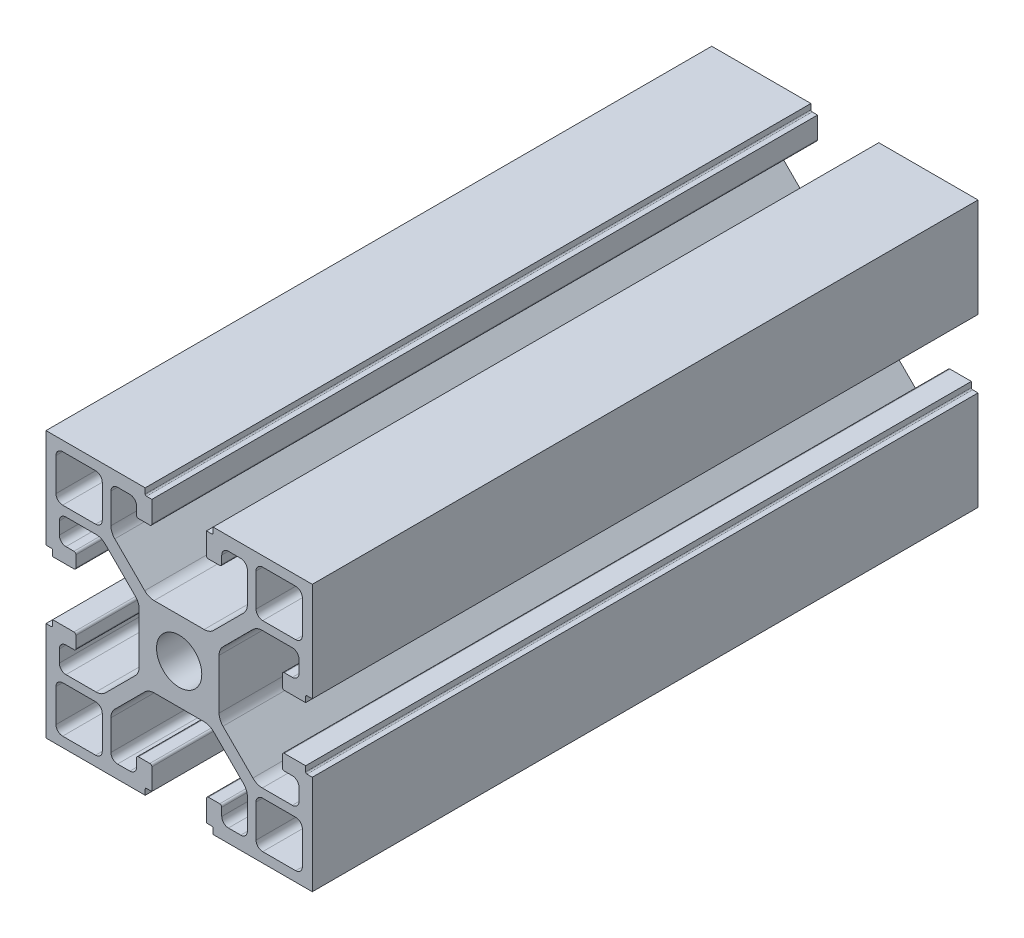
from build123d import *

# Parameters (mm, degrees)
SKETCH_1_R      = 3.4
EXTRUDE_1_DEPTH = 100


with BuildPart() as part:
    # 草图1 → 凸台-拉伸1 (new body)
    with BuildSketch(Plane.XY):
        with BuildLine():
            Line((-4.674392903, 18.940182328), (-19.574392903, 18.940182328))
            Line((-19.574392903, 18.940182328), (-19.574392903, 4.040182328))
            Line((-19.574392903, 4.040182328), (-18.774392903, 4.040182328))
            ThreePointArc((-18.774392903, 4.040182328), (-18.632971547, 3.981603684), (-18.574392903, 3.840182328))
            Line((-18.574392903, 3.840182328), (-18.574392903, 3.040182328))
            Line((-18.574392903, 3.040182328), (-15.374392903, 3.040182328))
            ThreePointArc((-15.374392903, 3.040182328), (-15.162260869, 3.128050294), (-15.074392903, 3.340182328))
            Line((-15.074392903, 3.340182328), (-15.074392903, 5.040182328))
            ThreePointArc((-15.074392903, 5.040182328), (-15.162260869, 5.252314363), (-15.374392903, 5.340182328))
            Line((-15.374392903, 5.340182328), (-16.574392903, 5.340182328))
            ThreePointArc((-16.574392903, 5.340182328), (-17.281499684, 5.633075547), (-17.574392903, 6.340182328))
            Line((-17.574392903, 6.340182328), (-17.574392903, 8.190182328))
            ThreePointArc((-17.574392903, 8.190182328), (-17.281499684, 8.897289109), (-16.574392903, 9.190182328))
            Line((-16.574392903, 9.190182328), (-12.06703359, 9.190182328))
            ThreePointArc((-12.06703359, 9.190182328), (-11.301666726, 9.037941393), (-10.652820028, 8.604395891))
            Line((-10.652820028, 8.604395891), (-6.160179341, 4.111755203))
            ThreePointArc((-6.160179341, 4.111755203), (-5.726633838, 3.462908506), (-5.574392903, 2.697541641))
            Line((-5.574392903, 2.697541641), (-5.574392903, -4.817176985))
            ThreePointArc((-5.574392903, -4.817176985), (-5.726633838, -5.582543849), (-6.160179341, -6.231390547))
            Line((-6.160179341, -6.231390547), (-10.652820028, -10.724031234))
            ThreePointArc((-10.652820028, -10.724031234), (-11.301666726, -11.157576737), (-12.06703359, -11.309817672))
            Line((-12.06703359, -11.309817672), (-16.574392903, -11.309817672))
            ThreePointArc((-16.574392903, -11.309817672), (-17.281499684, -11.016924453), (-17.574392903, -10.309817672))
            Line((-17.574392903, -10.309817672), (-17.574392903, -8.459817672))
            ThreePointArc((-17.574392903, -8.459817672), (-17.281499684, -7.752710891), (-16.574392903, -7.459817672))
            Line((-16.574392903, -7.459817672), (-15.374392903, -7.459817672))
            ThreePointArc((-15.374392903, -7.459817672), (-15.162260869, -7.371949706), (-15.074392903, -7.159817672))
            Line((-15.074392903, -7.159817672), (-15.074392903, -5.459817672))
            ThreePointArc((-15.074392903, -5.459817672), (-15.162260869, -5.247685637), (-15.374392903, -5.159817672))
            Line((-15.374392903, -5.159817672), (-18.574392903, -5.159817672))
            Line((-18.574392903, -5.159817672), (-18.574392903, -5.959817672))
            ThreePointArc((-18.574392903, -5.959817672), (-18.632971547, -6.101239028), (-18.774392903, -6.159817672))
            Line((-18.774392903, -6.159817672), (-19.574392903, -6.159817672))
            Line((-19.574392903, -6.159817672), (-19.574392903, -21.059817672))
            Line((-19.574392903, -21.059817672), (-4.674392903, -21.059817672))
            Line((-4.674392903, -21.059817672), (-4.674392903, -20.259817672))
            ThreePointArc((-4.674392903, -20.259817672), (-4.615814259, -20.118396316), (-4.474392903, -20.059817672))
            Line((-4.474392903, -20.059817672), (-3.674392903, -20.059817672))
            Line((-3.674392903, -20.059817672), (-3.674392903, -16.859817672))
            ThreePointArc((-3.674392903, -16.859817672), (-3.762260869, -16.647685637), (-3.974392903, -16.559817672))
            Line((-3.974392903, -16.559817672), (-5.674392903, -16.559817672))
            ThreePointArc((-5.674392903, -16.559817672), (-5.886524938, -16.647685637), (-5.974392903, -16.859817672))
            Line((-5.974392903, -16.859817672), (-5.974392903, -18.059817672))
            ThreePointArc((-5.974392903, -18.059817672), (-6.267286122, -18.766924453), (-6.974392903, -19.059817672))
            Line((-6.974392903, -19.059817672), (-8.824392903, -19.059817672))
            ThreePointArc((-8.824392903, -19.059817672), (-9.531499684, -18.766924453), (-9.824392903, -18.059817672))
            Line((-9.824392903, -18.059817672), (-9.824392903, -13.552458359))
            ThreePointArc((-9.824392903, -13.552458359), (-9.672151968, -12.787091494), (-9.238606466, -12.138244797))
            Line((-9.238606466, -12.138244797), (-4.745965779, -7.645604109))
            ThreePointArc((-4.745965779, -7.645604109), (-4.097119081, -7.212058607), (-3.331752216, -7.059817672))
            Line((-3.331752216, -7.059817672), (4.18296641, -7.059817672))
            ThreePointArc((4.18296641, -7.059817672), (4.948333274, -7.212058607), (5.597179972, -7.645604109))
            Line((5.597179972, -7.645604109), (10.089820659, -12.138244797))
            ThreePointArc((10.089820659, -12.138244797), (10.523366162, -12.787091494), (10.675607097, -13.552458359))
            Line((10.675607097, -13.552458359), (10.675607097, -18.059817672))
            ThreePointArc((10.675607097, -18.059817672), (10.382713878, -18.766924453), (9.675607097, -19.059817672))
            Line((9.675607097, -19.059817672), (7.825607097, -19.059817672))
            ThreePointArc((7.825607097, -19.059817672), (7.118500316, -18.766924453), (6.825607097, -18.059817672))
            Line((6.825607097, -18.059817672), (6.825607097, -16.859817672))
            ThreePointArc((6.825607097, -16.859817672), (6.737739131, -16.647685637), (6.525607097, -16.559817672))
            Line((6.525607097, -16.559817672), (4.825607097, -16.559817672))
            ThreePointArc((4.825607097, -16.559817672), (4.613475062, -16.647685637), (4.525607097, -16.859817672))
            Line((4.525607097, -16.859817672), (4.525607097, -20.059817672))
            Line((4.525607097, -20.059817672), (5.325607097, -20.059817672))
            ThreePointArc((5.325607097, -20.059817672), (5.467028453, -20.118396316), (5.525607097, -20.259817672))
            Line((5.525607097, -20.259817672), (5.525607097, -21.059817672))
            Line((5.525607097, -21.059817672), (20.425607097, -21.059817672))
            Line((20.425607097, -21.059817672), (20.425607097, -6.159817672))
            Line((20.425607097, -6.159817672), (19.625607097, -6.159817672))
            ThreePointArc((19.625607097, -6.159817672), (19.484185741, -6.101239028), (19.425607097, -5.959817672))
            Line((19.425607097, -5.959817672), (19.425607097, -5.159817672))
            Line((19.425607097, -5.159817672), (16.225607097, -5.159817672))
            ThreePointArc((16.225607097, -5.159817672), (16.013475062, -5.247685637), (15.925607097, -5.459817672))
            Line((15.925607097, -5.459817672), (15.925607097, -7.159817672))
            ThreePointArc((15.925607097, -7.159817672), (16.013475062, -7.371949706), (16.225607097, -7.459817672))
            Line((16.225607097, -7.459817672), (17.425607097, -7.459817672))
            ThreePointArc((17.425607097, -7.459817672), (18.132713878, -7.752710891), (18.425607097, -8.459817672))
            Line((18.425607097, -8.459817672), (18.425607097, -10.309817672))
            ThreePointArc((18.425607097, -10.309817672), (18.132713878, -11.016924453), (17.425607097, -11.309817672))
            Line((17.425607097, -11.309817672), (12.918247784, -11.309817672))
            ThreePointArc((12.918247784, -11.309817672), (12.152880919, -11.157576737), (11.504034221, -10.724031234))
            Line((11.504034221, -10.724031234), (7.011393534, -6.231390547))
            ThreePointArc((7.011393534, -6.231390547), (6.577848032, -5.582543849), (6.425607097, -4.817176985))
            Line((6.425607097, -4.817176985), (6.425607097, 2.697541641))
            ThreePointArc((6.425607097, 2.697541641), (6.577848032, 3.462908506), (7.011393534, 4.111755203))
            Line((7.011393534, 4.111755203), (11.504034221, 8.604395891))
            ThreePointArc((11.504034221, 8.604395891), (12.152880919, 9.037941393), (12.918247784, 9.190182328))
            Line((12.918247784, 9.190182328), (17.425607097, 9.190182328))
            ThreePointArc((17.425607097, 9.190182328), (18.132713878, 8.897289109), (18.425607097, 8.190182328))
            Line((18.425607097, 8.190182328), (18.425607097, 6.340182328))
            ThreePointArc((18.425607097, 6.340182328), (18.132713878, 5.633075547), (17.425607097, 5.340182328))
            Line((17.425607097, 5.340182328), (16.225607097, 5.340182328))
            ThreePointArc((16.225607097, 5.340182328), (16.013475062, 5.252314363), (15.925607097, 5.040182328))
            Line((15.925607097, 5.040182328), (15.925607097, 3.340182328))
            ThreePointArc((15.925607097, 3.340182328), (16.013475062, 3.128050294), (16.225607097, 3.040182328))
            Line((16.225607097, 3.040182328), (19.425607097, 3.040182328))
            Line((19.425607097, 3.040182328), (19.425607097, 3.840182328))
            ThreePointArc((19.425607097, 3.840182328), (19.484185741, 3.981603684), (19.625607097, 4.040182328))
            Line((19.625607097, 4.040182328), (20.425607097, 4.040182328))
            Line((20.425607097, 4.040182328), (20.425607097, 18.940182328))
            Line((20.425607097, 18.940182328), (5.525607097, 18.940182328))
            Line((5.525607097, 18.940182328), (5.525607097, 18.140182328))
            ThreePointArc((5.525607097, 18.140182328), (5.467028453, 17.998760972), (5.325607097, 17.940182328))
            Line((5.325607097, 17.940182328), (4.525607097, 17.940182328))
            Line((4.525607097, 17.940182328), (4.525607097, 14.740182328))
            ThreePointArc((4.525607097, 14.740182328), (4.613475062, 14.528050294), (4.825607097, 14.440182328))
            Line((4.825607097, 14.440182328), (6.525607097, 14.440182328))
            ThreePointArc((6.525607097, 14.440182328), (6.737739131, 14.528050294), (6.825607097, 14.740182328))
            Line((6.825607097, 14.740182328), (6.825607097, 15.940182328))
            ThreePointArc((6.825607097, 15.940182328), (7.118500316, 16.647289109), (7.825607097, 16.940182328))
            Line((7.825607097, 16.940182328), (9.675607097, 16.940182328))
            ThreePointArc((9.675607097, 16.940182328), (10.382713878, 16.647289109), (10.675607097, 15.940182328))
            Line((10.675607097, 15.940182328), (10.675607097, 11.432823015))
            ThreePointArc((10.675607097, 11.432823015), (10.523366162, 10.667456151), (10.089820659, 10.018609453))
            Line((10.089820659, 10.018609453), (5.597179972, 5.525968766))
            ThreePointArc((5.597179972, 5.525968766), (4.948333274, 5.092423263), (4.18296641, 4.940182328))
            Line((4.18296641, 4.940182328), (-3.331752216, 4.940182328))
            ThreePointArc((-3.331752216, 4.940182328), (-4.097119081, 5.092423263), (-4.745965779, 5.525968766))
            Line((-4.745965779, 5.525968766), (-9.238606466, 10.018609453))
            ThreePointArc((-9.238606466, 10.018609453), (-9.672151968, 10.667456151), (-9.824392903, 11.432823015))
            Line((-9.824392903, 11.432823015), (-9.824392903, 15.940182328))
            ThreePointArc((-9.824392903, 15.940182328), (-9.531499684, 16.647289109), (-8.824392903, 16.940182328))
            Line((-8.824392903, 16.940182328), (-6.974392903, 16.940182328))
            ThreePointArc((-6.974392903, 16.940182328), (-6.267286122, 16.647289109), (-5.974392903, 15.940182328))
            Line((-5.974392903, 15.940182328), (-5.974392903, 14.740182328))
            ThreePointArc((-5.974392903, 14.740182328), (-5.886524938, 14.528050294), (-5.674392903, 14.440182328))
            Line((-5.674392903, 14.440182328), (-3.974392903, 14.440182328))
            ThreePointArc((-3.974392903, 14.440182328), (-3.762260869, 14.528050294), (-3.674392903, 14.740182328))
            Line((-3.674392903, 14.740182328), (-3.674392903, 17.940182328))
            Line((-3.674392903, 17.940182328), (-4.474392903, 17.940182328))
            ThreePointArc((-4.474392903, 17.940182328), (-4.615814259, 17.998760972), (-4.674392903, 18.140182328))
            Line((-4.674392903, 18.140182328), (-4.674392903, 18.940182328))
        make_face()
        with Locations((0.425607097, -1.059817672)):
            Circle(SKETCH_1_R, mode=Mode.SUBTRACT)
        with BuildLine():
            Line((17.929607097, 17.444182328), (12.975607097, 17.444182328))
            ThreePointArc((12.975607097, 17.444182328), (12.268500316, 17.151289109), (11.975607097, 16.444182328))
            Line((11.975607097, 16.444182328), (11.975607097, 11.490182328))
            ThreePointArc((11.975607097, 11.490182328), (12.268500316, 10.783075547), (12.975607097, 10.490182328))
            Line((12.975607097, 10.490182328), (17.929607097, 10.490182328))
            ThreePointArc((17.929607097, 10.490182328), (18.636713878, 10.783075547), (18.929607097, 11.490182328))
            Line((18.929607097, 11.490182328), (18.929607097, 16.444182328))
            ThreePointArc((18.929607097, 16.444182328), (18.636713878, 17.151289109), (17.929607097, 17.444182328))
        make_face(mode=Mode.SUBTRACT)
        with BuildLine():
            Line((-17.078392903, 10.490182328), (-12.124392903, 10.490182328))
            ThreePointArc((-12.124392903, 10.490182328), (-11.417286122, 10.783075547), (-11.124392903, 11.490182328))
            Line((-11.124392903, 11.490182328), (-11.124392903, 16.444182328))
            ThreePointArc((-11.124392903, 16.444182328), (-11.417286122, 17.151289109), (-12.124392903, 17.444182328))
            Line((-12.124392903, 17.444182328), (-17.078392903, 17.444182328))
            ThreePointArc((-17.078392903, 17.444182328), (-17.785499684, 17.151289109), (-18.078392903, 16.444182328))
            Line((-18.078392903, 16.444182328), (-18.078392903, 11.490182328))
            ThreePointArc((-18.078392903, 11.490182328), (-17.785499684, 10.783075547), (-17.078392903, 10.490182328))
        make_face(mode=Mode.SUBTRACT)
        with BuildLine():
            Line((17.929607097, -19.563817672), (12.975607097, -19.563817672))
            ThreePointArc((12.975607097, -19.563817672), (12.268500316, -19.270924453), (11.975607097, -18.563817672))
            Line((11.975607097, -18.563817672), (11.975607097, -13.609817672))
            ThreePointArc((11.975607097, -13.609817672), (12.268500316, -12.902710891), (12.975607097, -12.609817672))
            Line((12.975607097, -12.609817672), (17.929607097, -12.609817672))
            ThreePointArc((17.929607097, -12.609817672), (18.636713878, -12.902710891), (18.929607097, -13.609817672))
            Line((18.929607097, -13.609817672), (18.929607097, -18.563817672))
            ThreePointArc((18.929607097, -18.563817672), (18.636713878, -19.270924453), (17.929607097, -19.563817672))
        make_face(mode=Mode.SUBTRACT)
        with BuildLine():
            Line((-12.124392903, -19.563817672), (-17.078392903, -19.563817672))
            ThreePointArc((-17.078392903, -19.563817672), (-17.785499684, -19.270924453), (-18.078392903, -18.563817672))
            Line((-18.078392903, -18.563817672), (-18.078392903, -13.609817672))
            ThreePointArc((-18.078392903, -13.609817672), (-17.785499684, -12.902710891), (-17.078392903, -12.609817672))
            Line((-17.078392903, -12.609817672), (-12.124392903, -12.609817672))
            ThreePointArc((-12.124392903, -12.609817672), (-11.417286122, -12.902710891), (-11.124392903, -13.609817672))
            Line((-11.124392903, -13.609817672), (-11.124392903, -18.563817672))
            ThreePointArc((-11.124392903, -18.563817672), (-11.417286122, -19.270924453), (-12.124392903, -19.563817672))
        make_face(mode=Mode.SUBTRACT)
    extrude(amount=EXTRUDE_1_DEPTH)


solid = part.part
